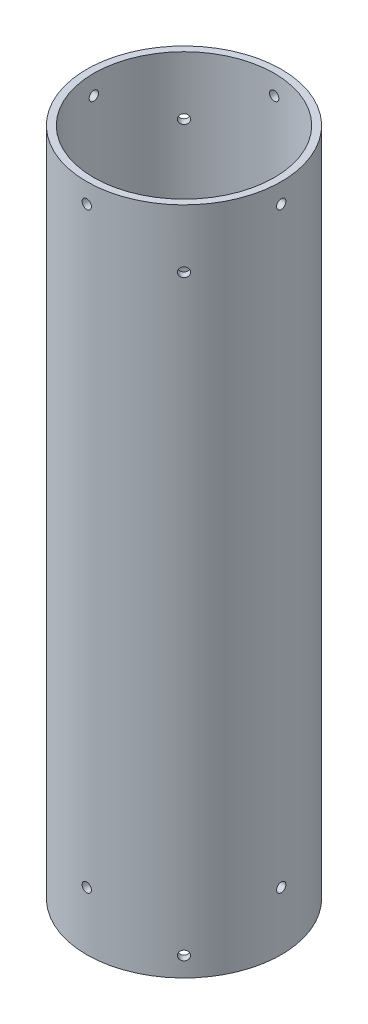
from build123d import *

# Parameters (mm, degrees)
SKETCH_1_R               = 25
SKETCH_1_R_2             = 23.2
EXTRUDE_1_DEPTH          = 172
SKETCH_3_R               = 1.2
CUT_EXTRUDE_2_DEPTH      = 176.59612752
PATTERN_CIRCULAR_1_COUNT = 4
SKETCH_11_R              = 1.2
CUT_EXTRUDE_10_DEPTH     = 176.596127648
PATTERN_CIRCULAR_2_COUNT = 4


with BuildPart() as part:
    # Эскиз1 → Бобышка-Вытянуть1 (new body)
    with BuildSketch(Plane(origin=(0, 0, 0), x_dir=(1, 0, 0), z_dir=(0, 1, 0))):
        with Locations(Location((0, 0, 0), (0, 0, 270))):
            Circle(SKETCH_1_R)
        with Locations(Location((0, 0, 0), (0, 0, 270))):
            Circle(SKETCH_1_R_2, mode=Mode.SUBTRACT)
    extrude(amount=EXTRUDE_1_DEPTH)

    # Эскиз3 → Вырез-Вытянуть2 (cut, through all)
    with BuildSketch(Plane(origin=(0, 0, 0), x_dir=(0, 0, -1), z_dir=(1, 0, 0))):
        with Locations((0, 167)):
            Circle(SKETCH_3_R)
        with Locations((0, 15)):
            Circle(SKETCH_3_R)
    cut_extrude_2 = extrude(amount=-CUT_EXTRUDE_2_DEPTH, mode=Mode.SUBTRACT)

    # Круговой массив1: Вырез-Вытянуть2 ×4 about axis
    pattern_circular_1_axis = Axis((0, 172, 0), (0, -1, 0))
    for i in range(1, PATTERN_CIRCULAR_1_COUNT):
        add(cut_extrude_2.rotate(pattern_circular_1_axis, i * 360 / PATTERN_CIRCULAR_1_COUNT), mode=Mode.SUBTRACT)

    # Эскиз11 → Вырез-Вытянуть10 (cut, through all)
    with BuildSketch(Plane(origin=(0, 0, 0), x_dir=(0, -1, 0), z_dir=(-0.7071067811865488, 0, 0.7071067811865464))):
        with Locations(Location((-5, 0, 0), (0, 0, 90))):
            Circle(SKETCH_11_R)
        with Locations(Location((-157, 0, 0), (0, 0, 90))):
            Circle(SKETCH_11_R)
    cut_extrude_10 = extrude(amount=-CUT_EXTRUDE_10_DEPTH, mode=Mode.SUBTRACT)

    # Круговой массив2: Вырез-Вытянуть10 ×4 about axis
    pattern_circular_2_axis = Axis((0, 172, 0), (0, -1, 0))
    for i in range(1, PATTERN_CIRCULAR_2_COUNT):
        add(cut_extrude_10.rotate(pattern_circular_2_axis, i * 360 / PATTERN_CIRCULAR_2_COUNT), mode=Mode.SUBTRACT)


solid = part.part
